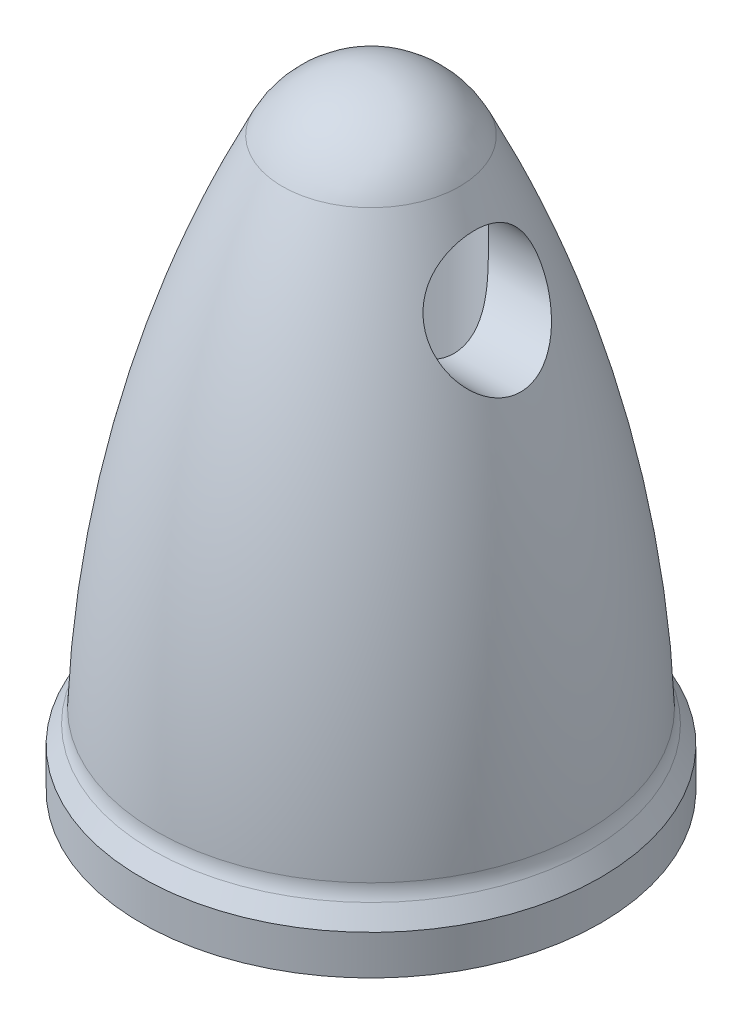
from build123d import *

# Parameters (mm, degrees)
SKETCH2_R               = 2.1336
CUT_EXTRUDE1_DEPTH      = 14.224
CHAMFER1_SIZE           = 2.032
CHAMFER1_SIZE2          = 1.173175747
CUT_EXTRUDE2_DEPTH      = 19.050314803
CUT_EXTRUDE2_DEPTH_BACK = 19.050314803
SKETCH3_R               = 1.4986
FILLET1_R               = 0.762


with BuildPart() as part:
    # Sketch1 → Revolve1 (revolve)
    with BuildSketch(Plane.XY):
        with BuildLine():
            Line((0, 0), (0, 16.002))
            ThreePointArc((0, 16.002), (1.342055956, 15.618498507), (2.278851705, 14.583799851))
            ThreePointArc((2.278851705, 14.583799851), (4.588242678, 8.28970248), (5.5245, 1.651))
            Line((5.5245, 1.651), (5.9055, 1.016))
            Line((5.9055, 1.016), (5.9055, 0))
            Line((5.9055, 0), (0, 0))
        make_face()
    revolve(axis=Axis((0, 16.002, 0), (0, 1, 0)))

    # Sketch2 → Cut-Extrude1 (cut)
    with BuildSketch(Plane.XZ):
        Circle(SKETCH2_R)
    extrude(amount=-CUT_EXTRUDE1_DEPTH, mode=Mode.SUBTRACT)

    # Chamfer1
    chamfer1_edges = [part.edges().sort_by_distance(p)[0] for p in [
        (-2.1336, 14.224, 0),
    ]]
    chamfer1_side = [part.faces().sort_by_distance(p)[0] for p in [
        (0, 14.224, 0),
    ]]
    chamfer(chamfer1_edges, length=CHAMFER1_SIZE, length2=CHAMFER1_SIZE2, reference=chamfer1_side[0])

    # Sketch3 → Cut-Extrude2 (cut, two sides: drawn at the far end of the back side and taken through both)
    with BuildSketch(Plane(origin=(0, 0, 0), x_dir=(0, 0, -1), z_dir=(1, 0, 0)).offset(-CUT_EXTRUDE2_DEPTH_BACK)):
        with Locations(Location((0, 12.2936, 0), (0, 0, 30.350455713))):
            Circle(SKETCH3_R)
    extrude(amount=CUT_EXTRUDE2_DEPTH + CUT_EXTRUDE2_DEPTH_BACK, mode=Mode.SUBTRACT)

    # Fillet1
    fillet1_edges = [part.edges().sort_by_distance(p)[0] for p in [
        (-5.5245, 1.651, 0),
    ]]
    fillet(fillet1_edges, radius=FILLET1_R)


solid = part.part
